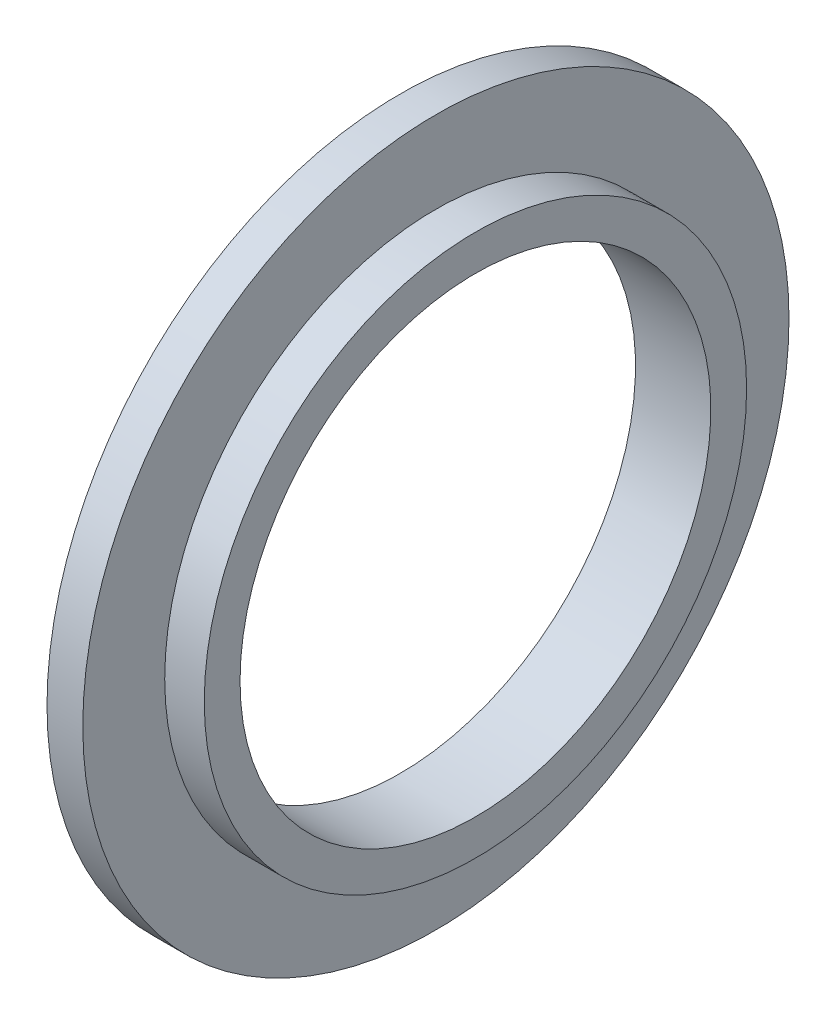
from build123d import *


with BuildPart() as part:
    # Esquisse1 → Base-Révol.-Mince (revolve)
    with BuildSketch(Plane.XY, mode=Mode.PRIVATE) as base_r_vol_mince_sk:
        Polygon((8, 25), (0, 25), (0, 37.5), (3.8, 37.5), (3.8, 28.8), (8, 28.8), align=None)
    revolve(base_r_vol_mince_sk.sketch.rotate(Axis((-20, 0, 0), (1, 0, 0)), 90), axis=Axis((-20, 0, 0), (1, 0, 0)))


solid = part.part
